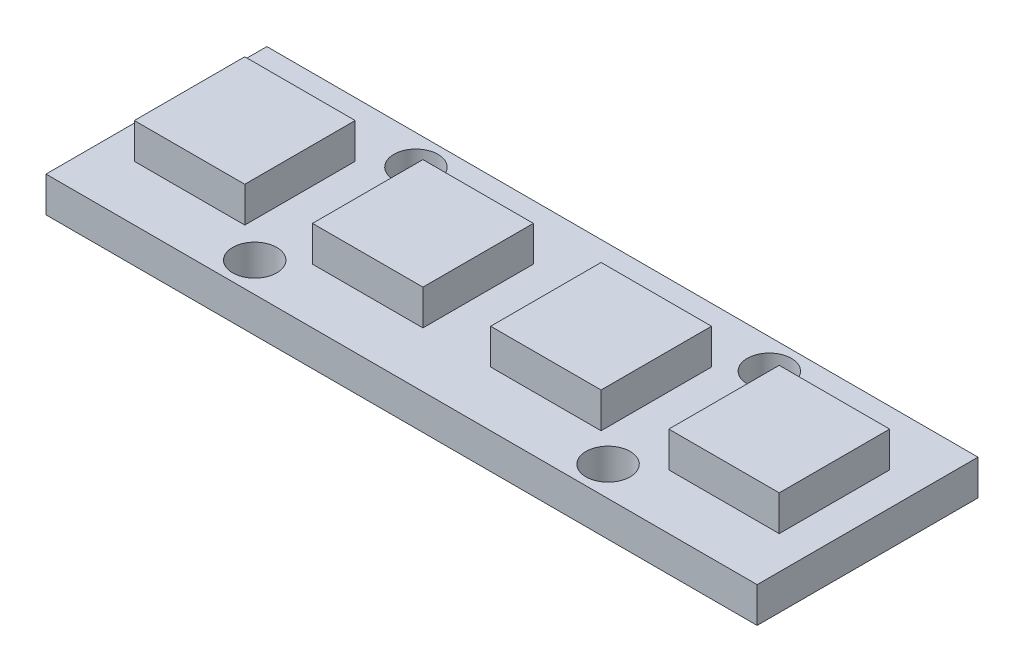
from build123d import *

# Parameters (mm, degrees)
SKETCH1_W           = 32.2
SKETCH1_H           = 10
SKETCH1_R           = 1
PCB_DEPTH           = 1.6
SKETCH2_W           = 5
SKETCH2_H           = 5
BOSS_EXTRUDE2_DEPTH = 1.6


with BuildPart() as part:
    # Sketch1 → PCB (new body)
    with BuildSketch(Plane(origin=(0, 0, 0), x_dir=(1, 0, 0), z_dir=(0, 1, 0))):
        Rectangle(SKETCH1_W, SKETCH1_H)
        with Locations(Location((-8, 3.65, 0), (0, 0, 270))):
            Circle(SKETCH1_R, mode=Mode.SUBTRACT)
        with Locations(Location((8, 3.65, 0), (0, 0, 270))):
            Circle(SKETCH1_R, mode=Mode.SUBTRACT)
        with Locations(Location((8, -3.65, 0), (0, 0, 90))):
            Circle(SKETCH1_R, mode=Mode.SUBTRACT)
        with Locations(Location((-8, -3.65, 0), (0, 0, 90))):
            Circle(SKETCH1_R, mode=Mode.SUBTRACT)
    extrude(amount=PCB_DEPTH)

    # Sketch2 → Boss-Extrude2 (add)
    with BuildSketch(Plane(origin=(0, 1.6, 0), x_dir=(1, 0, 0), z_dir=(0, 1, 0))):
        with Locations((-12.1, 0)):
            Rectangle(SKETCH2_W, SKETCH2_H)
        with Locations((-4.033333333, 0)):
            Rectangle(SKETCH2_W, SKETCH2_H)
        with Locations((4.033333333, 0)):
            Rectangle(SKETCH2_W, SKETCH2_H)
        with Locations((12.1, 0)):
            Rectangle(SKETCH2_W, SKETCH2_H)
    extrude(amount=BOSS_EXTRUDE2_DEPTH)


solid = part.part
